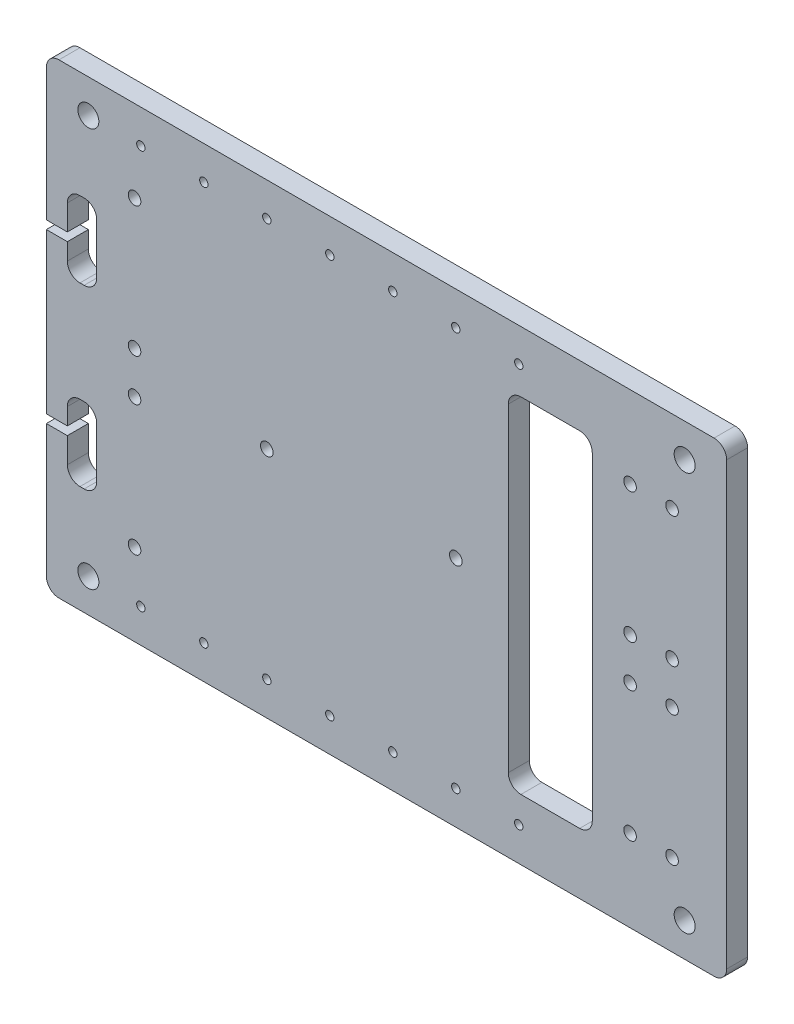
from build123d import *

# Parameters (mm, degrees)
SKETCH_1_W          = 162
SKETCH_1_H          = 111
EXTRUDE_1_DEPTH     = 5
CUT_EXTRUDE_1_REACH = 198.443
SKETCH_2_W          = 20
SKETCH_2_H          = 82
SKETCH_3_R          = 1.5
SKETCH_3_R_2        = 1
SKETCH_3_R_3        = 2.5
SKETCH_3_W          = 7
SKETCH_3_H          = 60
CUT_EXTRUDE_2_DEPTH = 5
FILLET_1_R          = 3
CUT_EXTRUDE_3_REACH = 198.443
SKETCH_4_R          = 1
SKETCH2_W           = 7
SKETCH2_H           = 24
BOSS_EXTRUDE2_DEPTH = 5
SKETCH3_W           = 5
SKETCH3_H           = 2
CUT_EXTRUDE1_DEPTH  = 197.443376065
FILLET1_R           = 3


with BuildPart() as part:
    # 草图1 → 凸台-拉伸1 (new body)
    with BuildSketch(Plane.XY):
        with Locations((81, -55.5)):
            Rectangle(SKETCH_1_W, SKETCH_1_H)
    extrude(amount=EXTRUDE_1_DEPTH)

    # 草图2 → 切除-拉伸1 (cut, up to next)
    with BuildSketch(Plane(origin=(0, 0, 0), x_dir=(-1, 0, 0), z_dir=(0, 0, -1)), mode=Mode.PRIVATE) as cut_extrude_1_sk1:
        with Locations((-120, -55.5)):
            Rectangle(SKETCH_2_W, SKETCH_2_H)
    cut_extrude_1_tool1 = extrude(cut_extrude_1_sk1.sketch, amount=-CUT_EXTRUDE_1_REACH, mode=Mode.PRIVATE) & part.part
    add(cut_extrude_1_tool1.solids().sort_by_distance((120, -55.5, 0))[0], mode=Mode.SUBTRACT)

    # 草图3 → 切除-拉伸2 (cut)
    with BuildSketch(Plane.XY.offset(5)):
        with Locations((149, -60.5)):
            Circle(SKETCH_3_R)
        with Locations((139, -60.5)):
            Circle(SKETCH_3_R)
        with Locations((149, -91.5)):
            Circle(SKETCH_3_R)
        with Locations((139, -91.5)):
            Circle(SKETCH_3_R)
        with Locations((149, -50.5)):
            Circle(SKETCH_3_R)
        with Locations((139, -50.5)):
            Circle(SKETCH_3_R)
        with Locations((22.5, -103)):
            Circle(SKETCH_3_R_2)
        with Locations((22.5, -8)):
            Circle(SKETCH_3_R_2)
        with Locations((21, -60.5)):
            Circle(SKETCH_3_R)
        with Locations((21, -91.5)):
            Circle(SKETCH_3_R)
        with Locations((21, -50.5)):
            Circle(SKETCH_3_R)
        with Locations((21, -19.5)):
            Circle(SKETCH_3_R)
        with Locations((10, -8)):
            Circle(SKETCH_3_R_3)
        with Locations((152, -8)):
            Circle(SKETCH_3_R_3)
        with Locations((152, -103)):
            Circle(SKETCH_3_R_3)
        with Locations((10, -103)):
            Circle(SKETCH_3_R_3)
        with Locations((37.5, -103)):
            Circle(SKETCH_3_R_2)
        with Locations((52.5, -103)):
            Circle(SKETCH_3_R_2)
        with Locations((67.5, -103)):
            Circle(SKETCH_3_R_2)
        with Locations((82.5, -103)):
            Circle(SKETCH_3_R_2)
        with Locations((97.5, -103)):
            Circle(SKETCH_3_R_2)
        with Locations((37.5, -8)):
            Circle(SKETCH_3_R_2)
        with Locations((52.5, -8)):
            Circle(SKETCH_3_R_2)
        with Locations((67.5, -8)):
            Circle(SKETCH_3_R_2)
        with Locations((82.5, -8)):
            Circle(SKETCH_3_R_2)
        with Locations((97.5, -8)):
            Circle(SKETCH_3_R_2)
        with Locations((112.5, -8)):
            Circle(SKETCH_3_R_2)
        with Locations((139, -19.5)):
            Circle(SKETCH_3_R)
        with Locations((149, -19.5)):
            Circle(SKETCH_3_R)
        with Locations((112.5, -103)):
            Circle(SKETCH_3_R_2)
        with Locations((52.5, -55.5)):
            Circle(SKETCH_3_R)
        with Locations((97.5, -55.5)):
            Circle(SKETCH_3_R)
        with Locations((8.5, -55.5)):
            Rectangle(SKETCH_3_W, SKETCH_3_H)
    extrude(amount=-CUT_EXTRUDE_2_DEPTH, mode=Mode.SUBTRACT)

    # 圆角1
    fillet_1_edges = [part.edges().sort_by_distance(p)[0] for p in [
        (5, -25.5, 2.5),
        (12, -25.5, 2.5),
        (12, -85.5, 2.5),
        (5, -85.5, 2.5),
        (110, -96.5, 2.5),
        (130, -96.5, 2.5),
        (130, -14.5, 2.5),
        (110, -14.5, 2.5),
        (0, 0, 2.5),
        (162, 0, 2.5),
        (162, -111, 2.5),
        (0, -111, 2.5),
    ]]
    fillet(fillet_1_edges, radius=FILLET_1_R)

    # 草图4 → 切除-拉伸3 (cut, up to next)
    with BuildSketch(Plane.ZY, mode=Mode.PRIVATE) as cut_extrude_3_sk1:
        with Locations(Location((2.5, -35.5, 0), (0, 0, 270))):
            Circle(SKETCH_4_R)
    cut_extrude_3_tool1 = extrude(cut_extrude_3_sk1.sketch, amount=-CUT_EXTRUDE_3_REACH, mode=Mode.PRIVATE) & part.part
    # 草图4 → 切除-拉伸3 (cut, up to next)
    with BuildSketch(Plane.ZY, mode=Mode.PRIVATE) as cut_extrude_3_sk2:
        with Locations(Location((2.5, -75.5, 0), (0, 0, 270))):
            Circle(SKETCH_4_R)
    cut_extrude_3_tool2 = extrude(cut_extrude_3_sk2.sketch, amount=-CUT_EXTRUDE_3_REACH, mode=Mode.PRIVATE) & part.part
    add(cut_extrude_3_tool1.solids().sort_by_distance((0, -35.5, 2.5))[0], mode=Mode.SUBTRACT)
    add(cut_extrude_3_tool2.solids().sort_by_distance((0, -75.5, 2.5))[0], mode=Mode.SUBTRACT)

    # Sketch2 → Boss-Extrude2 (add)
    with BuildSketch(Plane.XY):
        with Locations((8.5, -55.5)):
            Rectangle(SKETCH2_W, SKETCH2_H)
    extrude(amount=BOSS_EXTRUDE2_DEPTH)

    # Sketch3 → Cut-Extrude1 (cut, through all)
    with BuildSketch(Plane.XY.offset(5)):
        with Locations((2.5, -35.5)):
            Rectangle(SKETCH3_W, SKETCH3_H)
        with Locations((2.5, -75.5)):
            Rectangle(SKETCH3_W, SKETCH3_H)
    extrude(amount=-CUT_EXTRUDE1_DEPTH, mode=Mode.SUBTRACT)

    # Fillet1
    fillet1_edges = [part.edges().sort_by_distance(p)[0] for p in [
        (5, -67.5, 2.5),
        (12, -67.5, 2.5),
        (12, -43.5, 2.5),
        (5, -43.5, 2.5),
    ]]
    fillet(fillet1_edges, radius=FILLET1_R)


solid = part.part
